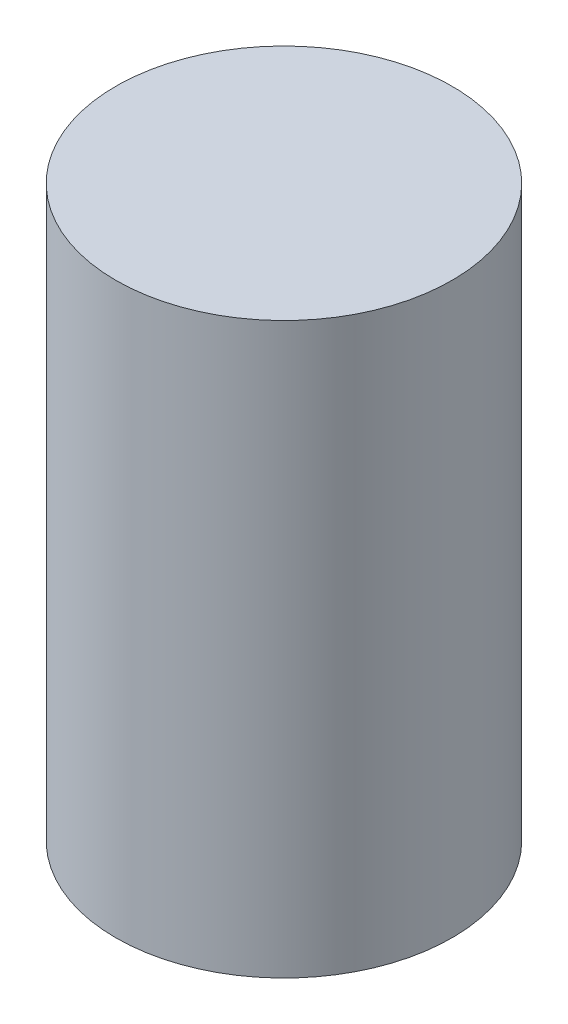
from build123d import *

# Parameters (mm, degrees)
SKETCH_1_R      = 7.5
EXTRUDE_1_DEPTH = 25.4


with BuildPart() as part:
    # 草图1 → 凸台-拉伸1 (new body)
    with BuildSketch(Plane(origin=(0, 0, 0), x_dir=(1, 0, 0), z_dir=(0, 1, 0))):
        with Locations(Location((0, 0, 0), (0, 0, 270))):
            Circle(SKETCH_1_R)
    extrude(amount=EXTRUDE_1_DEPTH)


solid = part.part
